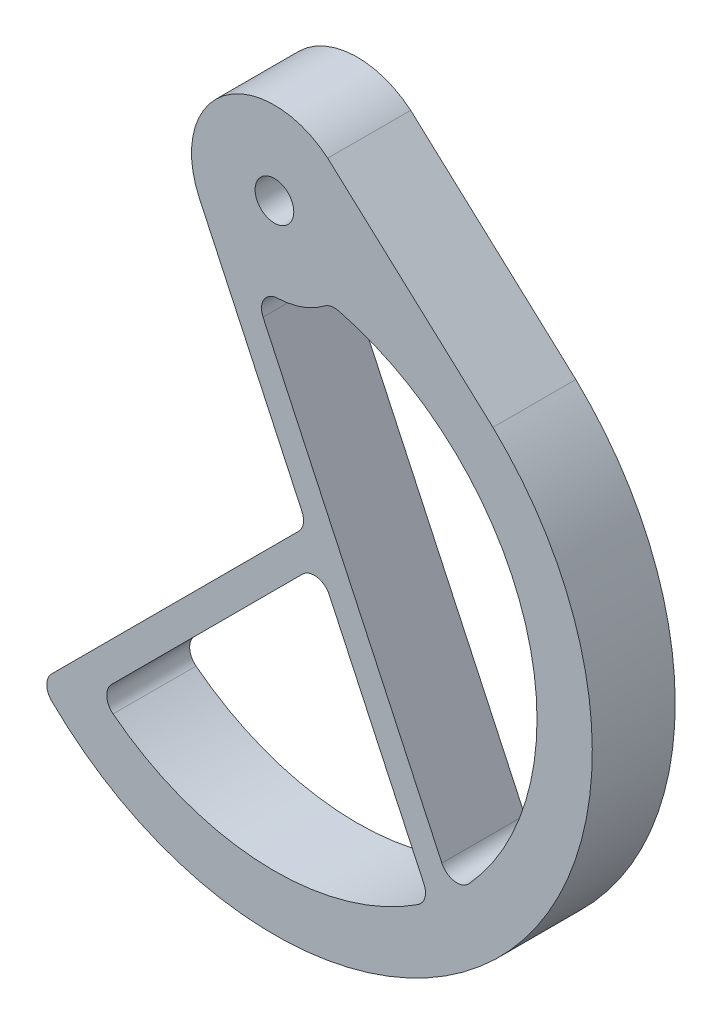
from build123d import *

# Parameters (mm, degrees)
EXTRUDE_1_DEPTH     = 15
SKETCH_6_R          = 3.5
CUT_EXTRUDE_2_DEPTH = 15
SKETCH_8_R          = 10.1
CUT_EXTRUDE_4_DEPTH = 2


with BuildPart() as part:
    # ｽｹｯﾁ1 → ﾎﾞｽ - 押し出し1 (new body)
    with BuildSketch(Plane.XY):
        with BuildLine():
            Line((10.546944731, 68.165925034), (9.641814145, 68.990666647))
            ThreePointArc((9.641814145, 68.990666647), (-9.131421435, 69.400300104), (-13.594616806, 51.160726074))
            Line((-13.594616806, 51.160726074), (4.986432096, 11.313538113))
            ThreePointArc((4.986432096, 11.313538113), (5.221931994, 9.524738795), (4.388829079, 7.924362985))
            Line((4.388829079, 7.924362985), (-40.303464689, -36.767930783))
            ThreePointArc((-40.303464689, -36.767930783), (-41.182112782, -38.903012739), (-40.283913759, -41.029943849))
            ThreePointArc((-40.283913759, -41.029943849), (41.397896806, -39.905690573), (39.524106652, 41.762363359))
            Line((39.524106652, 41.762363359), (37.916838192, 43.226882625))
            Line((37.916838192, 43.226882625), (10.546944731, 68.165925034))
        make_face()
        with BuildLine():
            ThreePointArc((5.093338956, 1.55780505), (7.735603832, 2.390907965), (9.933582661, 0.704339492))
            Line((9.933582661, 0.704339492), (27.046217634, -35.993824637))
            ThreePointArc((27.046217634, -35.993824637), (27.212084573, -38.085077821), (25.967336583, -39.773702754))
            ThreePointArc((25.967336583, -39.773702754), (-1.972837213, -47.459012983), (-29.17877254, -37.481318454))
            ThreePointArc((-29.17877254, -37.481318454), (-30.330146685, -35.299826939), (-29.457223039, -32.992756945))
            Line((-29.457223039, -32.992756945), (5.093338956, 1.55780505))
        make_face(mode=Mode.SUBTRACT)
        with BuildLine():
            ThreePointArc((35.231836325, -31.858557864), (32.560090836, -32.813013733), (30.287744354, -31.114293205))
            Line((30.287744354, -31.114293205), (-2.054746852, 38.244403012))
            ThreePointArc((-2.054746852, 38.244403012), (-1.895310582, 41.077194163), (0.553480425, 42.510214831))
            ThreePointArc((0.553480425, 42.510214831), (5.039223996, 43.371793408), (9.057681155, 45.543478261))
            ThreePointArc((9.057681155, 45.543478261), (10.270904088, 46.091905397), (11.601973614, 46.061309233))
            ThreePointArc((11.601973614, 46.061309233), (45.455779175, 13.784851815), (35.231836325, -31.858557864))
        make_face(mode=Mode.SUBTRACT)
    extrude(amount=EXTRUDE_1_DEPTH)

    # ｽｹｯﾁ6 → ｶｯﾄ - 押し出し2 (cut)
    with BuildSketch(Plane.XY.offset(15)):
        with Locations((0, 57.5)):
            Circle(SKETCH_6_R)
    extrude(amount=-CUT_EXTRUDE_2_DEPTH, mode=Mode.SUBTRACT)

    # ｽｹｯﾁ8 → ｶｯﾄ - 押し出し4 (cut)
    with BuildSketch(Plane(origin=(0, 0, 0), x_dir=(-1, 0, 0), z_dir=(0, 0, -1))):
        with Locations((0, 57.5)):
            Circle(SKETCH_8_R)
    extrude(amount=-CUT_EXTRUDE_4_DEPTH, mode=Mode.SUBTRACT)


solid = part.part
